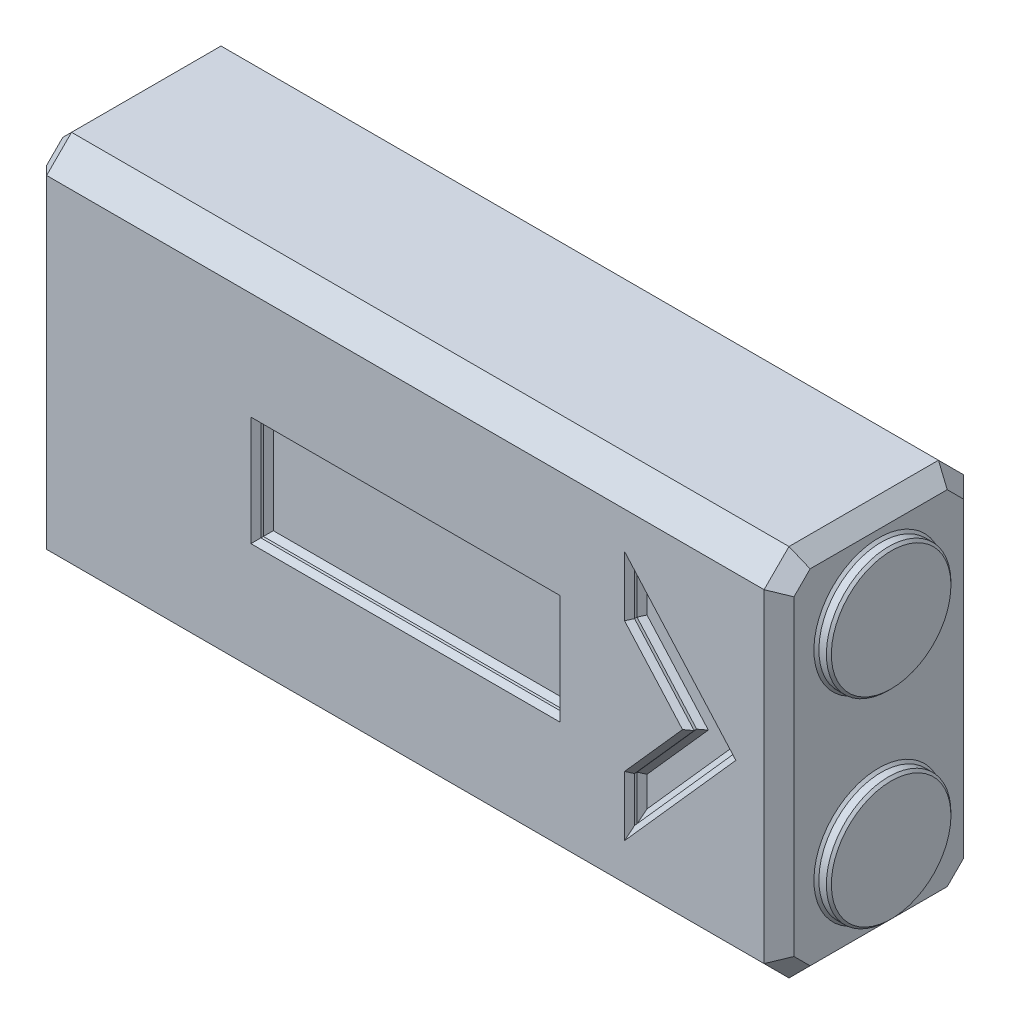
from build123d import *

# Parameters (mm, degrees)
SKETCH1_W             = 150
SKETCH1_H             = 300
BOSS_EXTRUDE1_DEPTH   = 40
SKETCH2_R             = 25
BOSS_EXTRUDE2_DEPTH   = 5
SKETCH3_W             = 40
SKETCH3_H             = 120
CUT_EXTRUDE1_DEPTH    = 5
CUT_EXTRUDE2_DEPTH    = 5
CHAMFER2_SIZE         = 10
CHAMFER3_SIZE         = 2
CHAMFER4_SIZE         = 1
CHAMFER5_SIZE         = 1
CHAMFER6_SIZE         = 6
BODY_MOVE_COPY1_ANGLE = 120


with BuildPart() as part:
    # Sketch1 → Boss-Extrude1 (new, symmetric)
    with BuildSketch(Plane(origin=(0, 0, 0), x_dir=(1, 0, 0), z_dir=(0, 1, 0))):
        Rectangle(SKETCH1_W, SKETCH1_H)
    extrude(amount=BOSS_EXTRUDE1_DEPTH, both=True)

    # Sketch2 → Boss-Extrude2 (add)
    with BuildSketch(Plane.XY.offset(150)):
        with Locations(Location((-40, 0, 0), (0, 0, 180))):
            Circle(SKETCH2_R)
        with Locations(Location((40, 0, 0), (0, 0, 180))):
            Circle(SKETCH2_R)
    boss_extrude2 = extrude(amount=BOSS_EXTRUDE2_DEPTH)

    # Sketch3 → Cut-Extrude1 (cut)
    with BuildSketch(Plane(origin=(0, 40, 0), x_dir=(1, 0, 0), z_dir=(0, 1, 0))):
        Rectangle(SKETCH3_W, SKETCH3_H)
    extrude(amount=-CUT_EXTRUDE1_DEPTH, mode=Mode.SUBTRACT)

    # Sketch4 → Cut-Extrude2 (cut)
    with BuildSketch(Plane(origin=(0, 40, 0), x_dir=(1, 0, 0), z_dir=(0, 1, 0))):
        Polygon((0, -130), (-45, -90), (-26.937608132, -90), (0, -113.944540562), (26.937608132, -90), (45, -90), align=None)
    extrude(amount=-CUT_EXTRUDE2_DEPTH, mode=Mode.SUBTRACT)

    # Chamfer2
    chamfer2_edges = [part.edges().sort_by_distance(p)[0] for p in [
        (75, 40, 0),
        (-75, 40, 0),
        (75, -40, 0),
        (-75, -40, 0),
    ]]
    chamfer(chamfer2_edges, length=CHAMFER2_SIZE)

    # Chamfer3
    chamfer3_edges = [part.edges().sort_by_distance(p)[0] for p in [
        (-20, 35, 0),
        (0, 35, -60),
        (20, 35, 0),
        (0, 35, 60),
        (-20, 40, 0),
        (0, 40, 60),
        (20, 40, 0),
        (0, 40, -60),
        (22.5, 35, 110),
        (-22.5, 35, 110),
        (-35.968804066, 35, 90),
        (-13.468804066, 35, 101.972270281),
        (13.468804066, 35, 101.972270281),
        (35.968804066, 35, 90),
        (22.5, 40, 110),
        (35.968804066, 40, 90),
        (13.468804066, 40, 101.972270281),
        (-13.468804066, 40, 101.972270281),
        (-35.968804066, 40, 90),
        (-22.5, 40, 110),
    ]]
    chamfer(chamfer3_edges, length=CHAMFER3_SIZE)

    # Mirror1: Boss-Extrude2 across plane
    add(boss_extrude2.mirror(Plane.XY))

    # Chamfer4
    chamfer4_edges = [part.edges().sort_by_distance(p)[0] for p in [
        (-15, 0, -155),
        (65, 0, -155),
        (-15, 0, 155),
        (65, 0, 155),
    ]]
    chamfer(chamfer4_edges, length=CHAMFER4_SIZE)

    # Chamfer5
    chamfer5_edges = [part.edges().sort_by_distance(p)[0] for p in [
        (-15, 0, 150),
        (-15, 0, -150),
        (65, 0, -150),
        (65, 0, 150),
    ]]
    chamfer(chamfer5_edges, length=CHAMFER5_SIZE)

    # Chamfer6
    chamfer6_edges = [part.edges().sort_by_distance(p)[0] for p in [
        (75, 0, -150),
        (75, 0, 150),
        (0, -40, -150),
        (-75, 0, -150),
        (0, 40, -150),
        (-70, 35, -150),
        (70, 35, -150),
        (-70, -35, -150),
        (70, -35, -150),
        (0, -40, 150),
        (0, 40, 150),
        (-75, 0, 150),
        (-70, 35, 150),
        (70, 35, 150),
        (-70, -35, 150),
        (70, -35, 150),
    ]]
    chamfer(chamfer6_edges, length=CHAMFER6_SIZE)


with BuildPart() as part_1:
    # Body-Move/Copy1: moved
    add(part.part.rotate(Axis((0, 0, 0), (0.5773502691896252, 0.5773502691896252, 0.5773502691896272)), BODY_MOVE_COPY1_ANGLE))


solid = part_1.part
